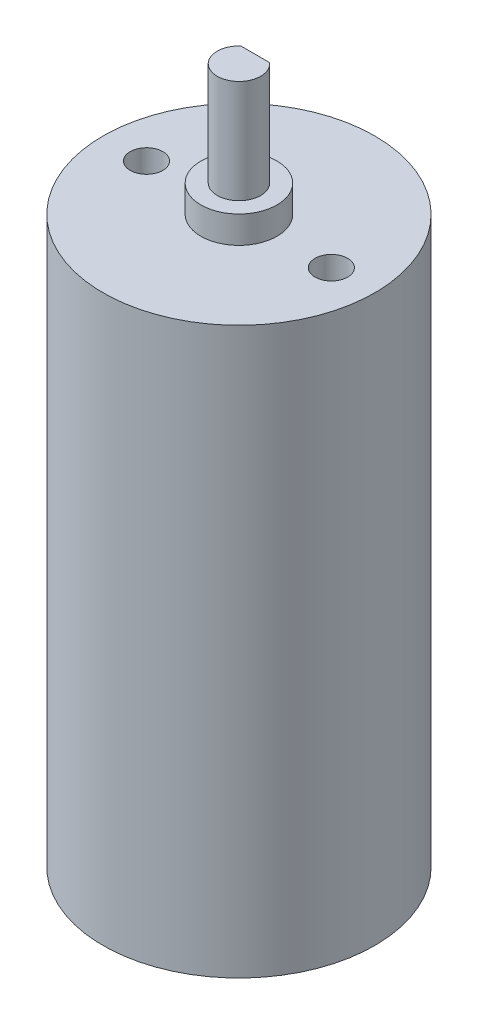
from build123d import *

# Parameters (mm, degrees)
SKETCH1_R           = 12.5
BOSS_EXTRUDE1_DEPTH = 52
SKETCH2_R           = 3.5
BOSS_EXTRUDE2_DEPTH = 2.5
BOSS_EXTRUDE3_DEPTH = 9.5
SKETCH4_R           = 1.5
CUT_EXTRUDE1_DEPTH  = 8


with BuildPart() as part:
    # Sketch1 → Boss-Extrude1 (new body)
    with BuildSketch(Plane(origin=(0, 0, 0), x_dir=(1, 0, 0), z_dir=(0, 1, 0))):
        with Locations(Location((0, 0, 0), (0, 0, 90))):
            Circle(SKETCH1_R)
    extrude(amount=BOSS_EXTRUDE1_DEPTH)

    # Sketch2 → Boss-Extrude2 (add)
    with BuildSketch(Plane(origin=(0, 52, 0), x_dir=(1, 0, 0), z_dir=(0, 1, 0))):
        with Locations(Location((0, 0, 0), (0, 0, 270))):
            Circle(SKETCH2_R)
    extrude(amount=BOSS_EXTRUDE2_DEPTH)

    # Sketch3 → Boss-Extrude3 (add)
    with BuildSketch(Plane(origin=(0, 54.5, 0), x_dir=(1, 0, 0), z_dir=(0, 1, 0))):
        with BuildLine():
            ThreePointArc((-1.322875656, 1.5), (-1.870828693, -0.707106781), (0, -2))
            Line((0, -2), (0, 1.5))
            Line((0, 1.5), (-1.322875656, 1.5))
        make_face()
        with BuildLine():
            Line((0, 1.5), (0, -2))
            ThreePointArc((0, -2), (1.870828693, -0.707106781), (1.322875656, 1.5))
            Line((1.322875656, 1.5), (0, 1.5))
        make_face()
    extrude(amount=BOSS_EXTRUDE3_DEPTH)

    # Sketch4 → Cut-Extrude1 (cut)
    with BuildSketch(Plane(origin=(0, 52, 0), x_dir=(1, 0, 0), z_dir=(0, 1, 0))):
        with BuildLine():
            ThreePointArc((-7, 0), (-8.5, 1.5), (-10, 0))
            Line((-10, 0), (-7, 0))
        make_face()
        with BuildLine():
            Line((-7, 0), (-10, 0))
            ThreePointArc((-10, 0), (-8.5, -1.5), (-7, 0))
        make_face()
        with Locations(Location((8.5, 0, 0), (0, 0, 270))):
            Circle(SKETCH4_R)
    extrude(amount=-CUT_EXTRUDE1_DEPTH, mode=Mode.SUBTRACT)


solid = part.part
